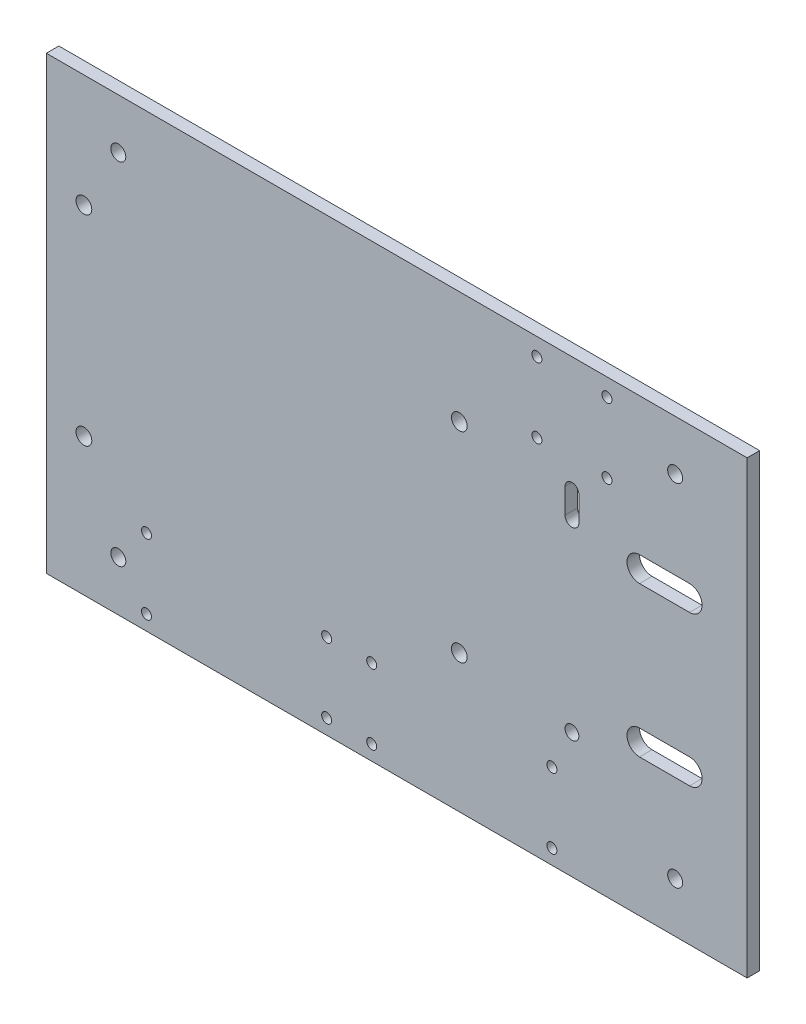
from build123d import *

# Parameters (mm, degrees)
SKETCH1_W                      = 177.8
SKETCH1_H                      = 114.3
BOSS_EXTRUDE1_DEPTH            = 3.175
SKETCH8_R                      = 2
CUT_EXTRUDE2_DEPTH             = 106.732743864
SKETCH9_R                      = 1.27
CUT_EXTRUDE3_DEPTH             = 106.732743864
LPATTERN1_COUNT                = 2
LPATTERN1_PITCH                = 57.15
SKETCH10_R                     = 1.27
CUT_EXTRUDE4_DEPTH             = 106.732743864
SKETCH11_R                     = 1.75
CUT_EXTRUDE5_DEPTH             = 106.732743864
F_6_CLEARANCE_HOLE1_AT_2_COUNT = 2
F_6_CLEARANCE_HOLE1_AT_2_PITCH = 88.9
CUT_EXTRUDE6_DEPTH             = 106.732743864


with BuildPart() as part:
    # Sketch1 → Boss-Extrude1 (new body)
    with BuildSketch(Plane.XY):
        Rectangle(SKETCH1_W, SKETCH1_H)
    extrude(amount=BOSS_EXTRUDE1_DEPTH)

    # Sketch8 → Cut-Extrude2 (cut, through all)
    with BuildSketch(Plane.XY.offset(3.175)):
        with Locations((-79.375, 28.575)):
            Circle(SKETCH8_R)
        with Locations((15.875, 28.575)):
            Circle(SKETCH8_R)
        with Locations((15.875, -22.225)):
            Circle(SKETCH8_R)
        with Locations((-79.375, -22.225)):
            Circle(SKETCH8_R)
    extrude(amount=-CUT_EXTRUDE2_DEPTH, mode=Mode.SUBTRACT)

    # Sketch9 → Cut-Extrude3 (cut, through all)
    with BuildSketch(Plane.XY.offset(3.175)):
        with Locations((-63.5, -35.56)):
            Circle(SKETCH9_R)
        with Locations((-17.78, -35.56)):
            Circle(SKETCH9_R)
        with Locations((-17.78, -53.34)):
            Circle(SKETCH9_R)
        with Locations((-63.5, -53.34)):
            Circle(SKETCH9_R)
    cut_extrude3 = extrude(amount=-CUT_EXTRUDE3_DEPTH, mode=Mode.SUBTRACT)

    # LPattern1: Cut-Extrude3 ×2
    with Locations(*[(i * LPATTERN1_PITCH, 0, 0) for i in range(1, LPATTERN1_COUNT)]):
        add(cut_extrude3, mode=Mode.SUBTRACT)

    # Sketch10 → Cut-Extrude4 (cut, through all)
    with BuildSketch(Plane.XY.offset(3.175)):
        with Locations((35.56, 52.705)):
            Circle(SKETCH10_R)
        with Locations((53.34, 52.705)):
            Circle(SKETCH10_R)
        with Locations((53.34, 34.925)):
            Circle(SKETCH10_R)
        with Locations((35.56, 34.925)):
            Circle(SKETCH10_R)
    extrude(amount=-CUT_EXTRUDE4_DEPTH, mode=Mode.SUBTRACT)

    # Sketch11 → Cut-Extrude5 (cut, through all)
    with BuildSketch(Plane.XY.offset(3.175)):
        with Locations((44.45, -25.4)):
            Circle(SKETCH11_R)
        with BuildLine():
            Line((42.7, 21.425), (42.7, 27.775))
            ThreePointArc((42.7, 27.775), (44.45, 29.525), (46.2, 27.775))
            Line((46.2, 27.775), (46.2, 21.425))
            ThreePointArc((46.2, 21.425), (44.45, 19.675), (42.7, 21.425))
        make_face()
    extrude(amount=-CUT_EXTRUDE5_DEPTH, mode=Mode.SUBTRACT)

    # Sketch15 → #6 Clearance Hole1 (revolve, cut)
    with BuildSketch(Plane(origin=(70.64375, 44.45, 0), x_dir=(0, 1, 0), z_dir=(1, 0, 0))):
        Polygon((0, 0), (0, 26.540824014), (1.89865, 25.4), (1.89865, 0), align=None)
    f_6_clearance_hole1 = revolve(axis=Axis((70.64375, 44.45, -6.35), (0, 0, 1)), mode=Mode.SUBTRACT)

    # #6 Clearance Hole1 at 2: #6 Clearance Hole1 ×2
    with Locations(*[(0, -i * F_6_CLEARANCE_HOLE1_AT_2_PITCH, 0) for i in range(1, F_6_CLEARANCE_HOLE1_AT_2_COUNT)]):
        add(f_6_clearance_hole1, mode=Mode.SUBTRACT)

    # Sketch16 → Cut-Extrude6 (cut, through all)
    with BuildSketch(Plane(origin=(0, 0, 0), x_dir=(-1, 0, 0), z_dir=(0, 0, -1))):
        with BuildLine():
            Line((-74.295, 22.225), (-61.595, 22.225))
            ThreePointArc((-61.595, 22.225), (-58.42, 19.05), (-61.595, 15.875))
            Line((-61.595, 15.875), (-74.295, 15.875))
            ThreePointArc((-74.295, 15.875), (-77.47, 19.05), (-74.295, 22.225))
        make_face()
    cut_extrude6 = extrude(amount=-CUT_EXTRUDE6_DEPTH, mode=Mode.SUBTRACT)

    # Mirror4: Cut-Extrude6 across plane
    add(cut_extrude6.mirror(Plane.ZX), mode=Mode.SUBTRACT)

    # Mirror5: #6 Clearance Hole1 across plane
    add(f_6_clearance_hole1.mirror(Plane(origin=(0, 0, 0), x_dir=(0, 0, 1), z_dir=(1, 0, 0))), mode=Mode.SUBTRACT)

    # Mirror5 copy 1 sketch → Mirror5 copy 1 (revolve, cut)
    with BuildSketch(Plane(origin=(-70.64375, -44.45, 0), x_dir=(0, 1, 0), z_dir=(-1, 0, 0))):
        Polygon((0, 0), (0, -26.540824014), (1.89865, -25.4), (1.89865, 0), align=None)
    revolve(axis=Axis((-70.64375, -44.45, -6.35), (0, 0, -1)), mode=Mode.SUBTRACT)


solid = part.part
